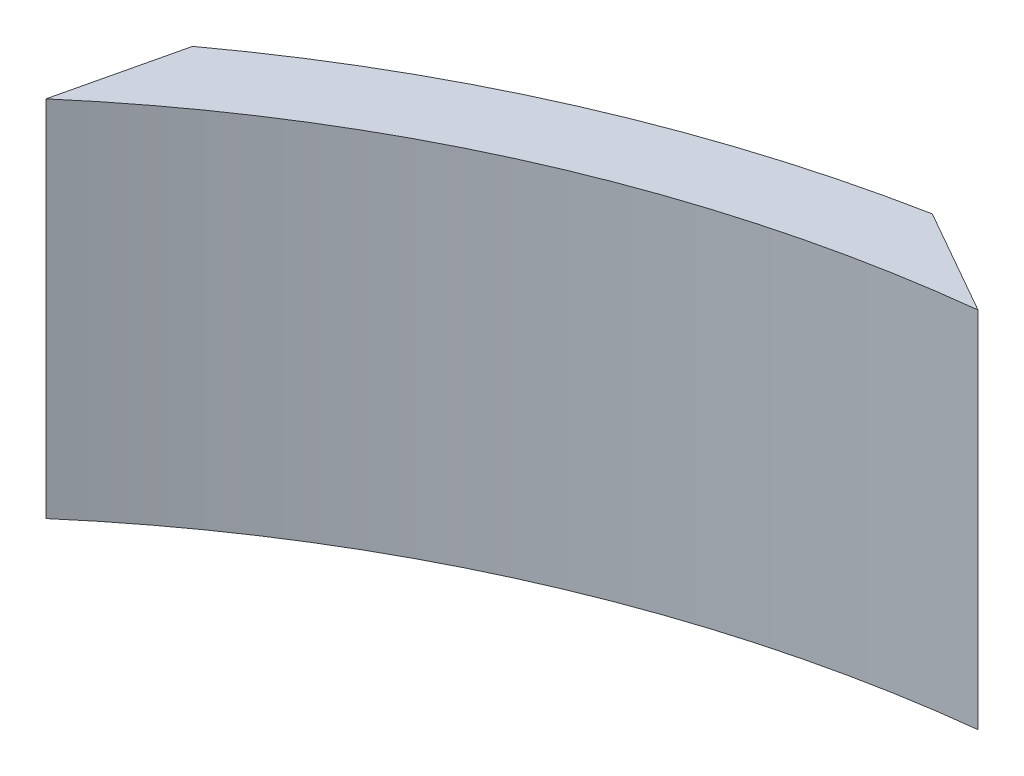
from build123d import *

# Parameters (mm, degrees)
RESSALTO_EXTRUS_O1_DEPTH = 12


with BuildPart() as part:
    # Esboço1 → Ressalto-extrusão1 (new, symmetric)
    with BuildSketch(Plane(origin=(0, 0, 0), x_dir=(1, 0, 0), z_dir=(0, 1, 0))):
        with BuildLine():
            Line((-17, 7.489258773), (-24, 11.472335939))
            ThreePointArc((-24, 11.472335939), (-41.823956416, 5.939800068), (-58, -3.368152954))
            Line((-58, -3.368152954), (-59.838911655, -11.209282186))
            ThreePointArc((-59.838911655, -11.209282186), (-39.823767083, 1.35730701), (-17, 7.489258773))
        make_face()
    extrude(amount=RESSALTO_EXTRUS_O1_DEPTH, both=True)


solid = part.part
